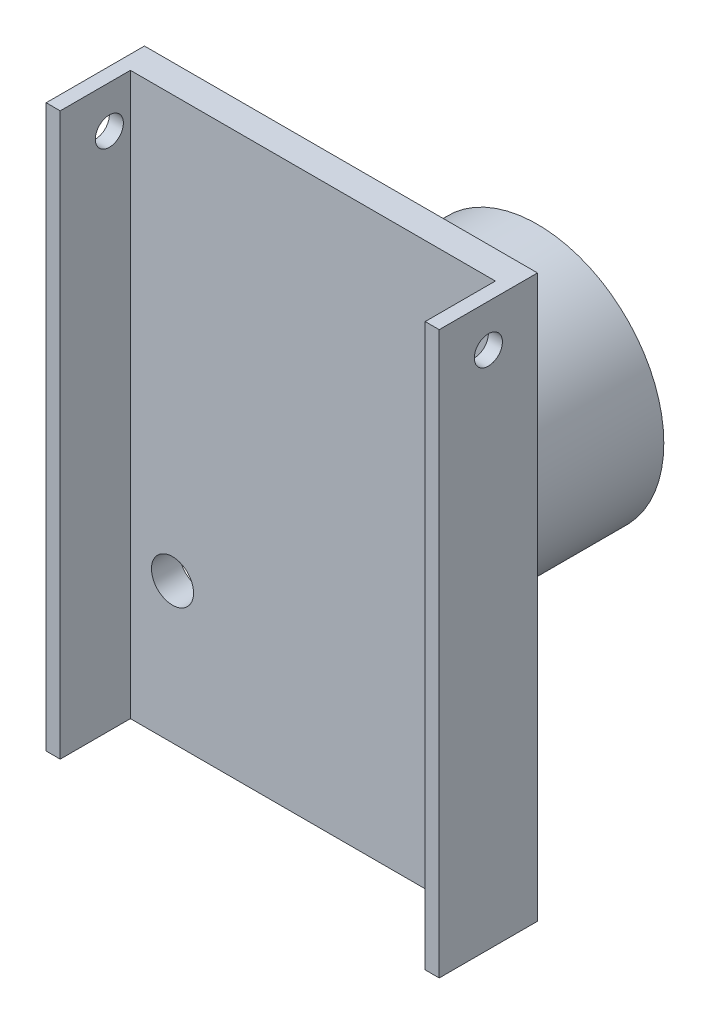
from build123d import *

# Parameters (mm, degrees)
SKETCH1_W           = 140
SKETCH1_H           = 200
SKETCH1_R           = 7.5
BOSS_EXTRUDE1_DEPTH = 10
SKETCH2_W           = 5
SKETCH2_H           = 200
BOSS_EXTRUDE2_DEPTH = 25
SKETCH3_R           = 5
CUT_EXTRUDE1_DEPTH  = 176.570498661
SKETCH4_R           = 45
SKETCH4_R_2         = 35
BOSS_EXTRUDE3_DEPTH = 70
FILLET1_R           = 10


with BuildPart() as part:
    # Sketch1 → Boss-Extrude1 (new body)
    with BuildSketch(Plane.XY):
        Rectangle(SKETCH1_W, SKETCH1_H)
        with Locations((-50, -50)):
            Circle(SKETCH1_R, mode=Mode.SUBTRACT)
        with Locations((50, -50)):
            Circle(SKETCH1_R, mode=Mode.SUBTRACT)
    extrude(amount=BOSS_EXTRUDE1_DEPTH)

    # Sketch2 → Boss-Extrude2 (add)
    with BuildSketch(Plane.XY.offset(10)):
        with Locations((-67.5, 0)):
            Rectangle(SKETCH2_W, SKETCH2_H)
        with Locations((67.5, 0)):
            Rectangle(SKETCH2_W, SKETCH2_H)
    extrude(amount=BOSS_EXTRUDE2_DEPTH)

    # Sketch3 → Cut-Extrude1 (cut, through all)
    with BuildSketch(Plane.ZY.offset(70)):
        with Locations(Location((17.5, 85, 0), (0, 0, 270))):
            Circle(SKETCH3_R)
    extrude(amount=-CUT_EXTRUDE1_DEPTH, mode=Mode.SUBTRACT)

    # Sketch4 → Boss-Extrude3 (add)
    with BuildSketch(Plane(origin=(0, 0, 0), x_dir=(-1, 0, 0), z_dir=(0, 0, -1))):
        with Locations(Location((0, 0, 0), (0, 0, 180))):
            Circle(SKETCH4_R)
        Circle(SKETCH4_R_2, mode=Mode.SUBTRACT)
    extrude(amount=BOSS_EXTRUDE3_DEPTH)

    # Fillet1
    fillet1_edges = [part.edges().sort_by_distance(p)[0] for p in [
        (-45, 0, 0),
    ]]
    fillet(fillet1_edges, radius=FILLET1_R)


solid = part.part
